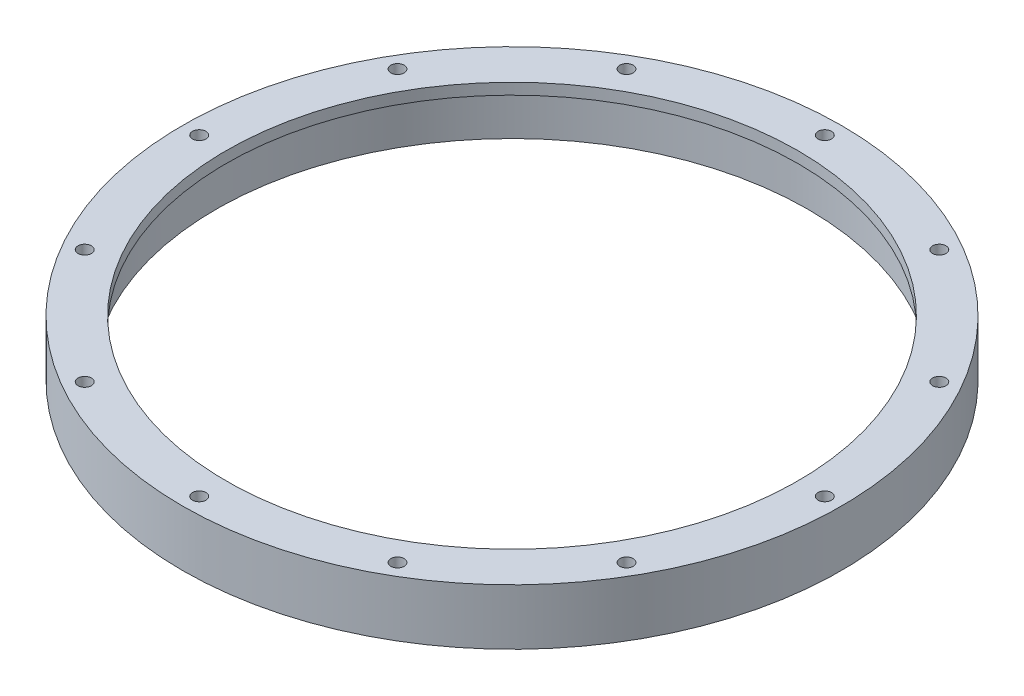
from build123d import *

# Parameters (mm, degrees)
SKETCH_2_R               = 1.2
CUT_EXTRUDE_1_DEPTH      = 10
PATTERN_CIRCULAR_1_COUNT = 12


with BuildPart() as part:
    # 草图1 → 旋转1 (revolve)
    with BuildSketch(Plane.XY, mode=Mode.PRIVATE) as revolve_1_sk:
        Polygon((-53, 0), (-59, 0), (-59, 10), (-51.2, 10), (-51.2, 8), (-53, 8), align=None)
    revolve(revolve_1_sk.sketch.rotate(Axis((0, 0, 0), (0, 1, 0)), 270), axis=Axis((0, 0, 0), (0, 1, 0)))

    # 草图2 → 切除-拉伸1 (cut)
    with BuildSketch(Plane.XZ):
        with Locations(Location((0, 56, 0), (0, 0, 270))):
            Circle(SKETCH_2_R)
    cut_extrude_1 = extrude(amount=-CUT_EXTRUDE_1_DEPTH, mode=Mode.SUBTRACT)

    # 阵列(圆周)1: 切除-拉伸1 ×12 about axis
    pattern_circular_1_axis = Axis((0, 0, 0), (0, 1, 0))
    for i in range(1, PATTERN_CIRCULAR_1_COUNT):
        add(cut_extrude_1.rotate(pattern_circular_1_axis, i * 360 / PATTERN_CIRCULAR_1_COUNT), mode=Mode.SUBTRACT)


solid = part.part
